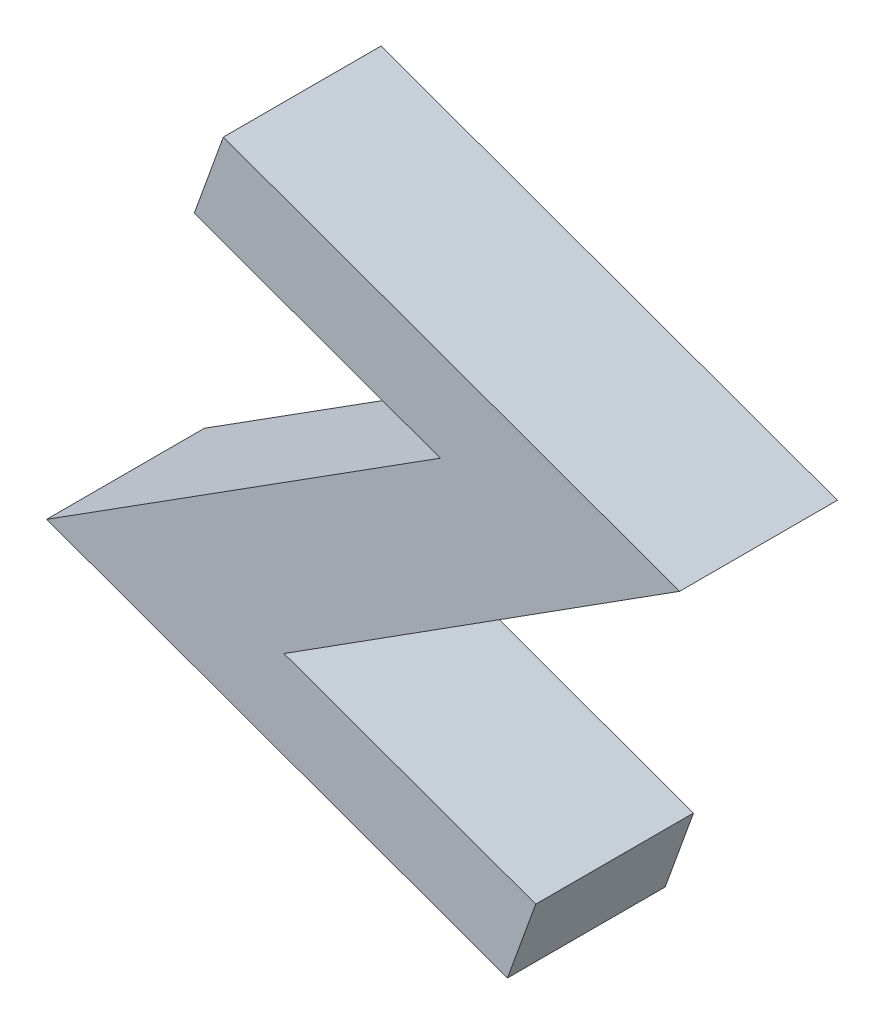
from build123d import *

# Parameters (mm, degrees)
BOSS_EXTRUDE1_DEPTH = 6.604


with BuildPart() as part:
    # Sketch1 → Boss-Extrude1 (new body)
    with BuildSketch(Plane.XY):
        Polygon((-7.327405634, 13.353279346), (11.779835952, 6.434679586), (-4.785879192, -4.105404548), (5.754204943, -7.921510318), (4.571212154, -11.191912962), (-14.726834721, -4.208439404), (1.758742202, 6.251506509), (-8.544743375, 9.983657952), align=None)
    extrude(amount=BOSS_EXTRUDE1_DEPTH)


solid = part.part
